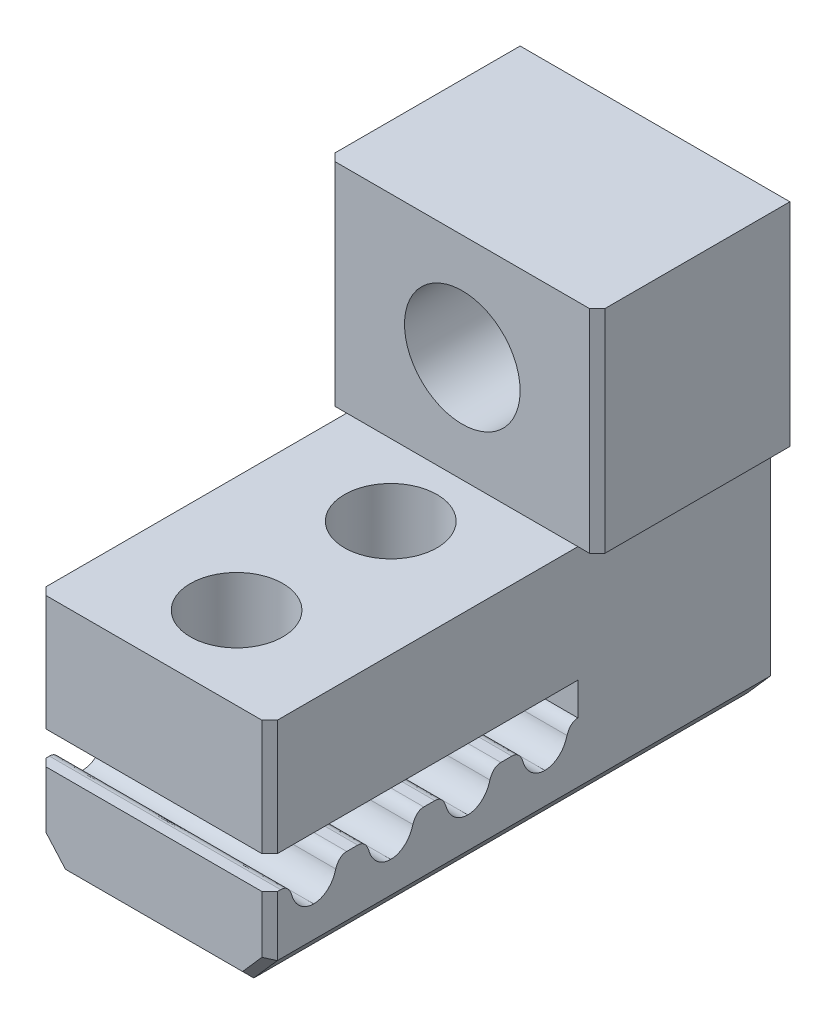
from build123d import *

# Parameters (mm, degrees)
BOSS_EXTRUDE1_DEPTH     = 13
SKETCH6_W               = 6
SKETCH6_H               = 5
BOSS_EXTRUDE4_DEPTH     = 5.6
SKETCH16_W              = 6
SKETCH16_H              = 8
BOSS_EXTRUDE5_DEPTH     = 0.1
CUT_EXTRUDE6_DEPTH      = 4
CUT_EXTRUDE6_DEPTH_BACK = 3.6
SKETCH15_R              = 1.2
CUT_EXTRUDE7_DEPTH      = 8.7202
CUT_EXTRUDE8_START      = -0.2202
SKETCH19_W              = 6
SKETCH19_H              = 8
SKETCH19_R              = 1.2
CUT_EXTRUDE8_DEPTH      = 0.2202
SKETCH12_R              = 1.5
CUT_EXTRUDE5_DEPTH      = 6
CHAMFER1_SIZE           = 0.2
SKETCH20_W              = 5
SKETCH20_H              = 5.5
BOSS_EXTRUDE6_DEPTH     = 0.5
SKETCH21_W              = 5
SKETCH21_H              = 5.5
BOSS_EXTRUDE7_DEPTH     = 0.5
CHAMFER2_SIZE           = 0.2


with BuildPart() as part:
    # Sketch1 → Boss-Extrude1 (new body)
    with BuildSketch(Plane.XY):
        Polygon((3, 3.05), (3, -2.253801214), (2.388188946, -2.95), (-2.388188946, -2.95), (-3, -2.253801214), (-3, 3.05), align=None)
    extrude(amount=BOSS_EXTRUDE1_DEPTH)

    # Sketch6 → Boss-Extrude4 (add)
    with BuildSketch(Plane(origin=(0, 3.05, 0), x_dir=(1, 0, 0), z_dir=(0, 1, 0))):
        with Locations((0, -2.5)):
            Rectangle(SKETCH6_W, SKETCH6_H)
    extrude(amount=BOSS_EXTRUDE4_DEPTH)

    # Sketch16 → Boss-Extrude5 (add)
    with BuildSketch(Plane(origin=(0, 3.05, 0), x_dir=(1, 0, 0), z_dir=(0, 1, 0))):
        with Locations((0, -9)):
            Rectangle(SKETCH16_W, SKETCH16_H)
    extrude(amount=BOSS_EXTRUDE5_DEPTH)

    # Sketch18 → Cut-Extrude6 (cut, two sides: drawn at the far end of the back side and taken through both)
    with BuildSketch(Plane(origin=(0, 0, 0), x_dir=(0, 0, -1), z_dir=(1, 0, 0)).offset(-CUT_EXTRUDE6_DEPTH_BACK)):
        with BuildLine():
            Line((-8.8572, -0.0702), (-12.8572, -0.0702))
            Line((-12.8572, -0.0702), (-13, -0.0702))
            Line((-13, -0.0702), (-13, -0.7))
            Line((-13, -0.7), (-12.8572, -0.7))
            Line((-12.8572, -0.7), (-12.7144, -0.7))
            add(Edge.make_bspline(
                [(-12.7144, -0.7), (-12.5198, -0.7), (-12.43, -0.9509)],
                knots=[0.103448276, 0.103448276, 0.103448276, 0.137931034, 0.137931034, 0.137931034], degree=2))
            add(Edge.make_bspline(
                [(-12.43, -0.9509), (-12.3594, -1.2388), (-12.13, -1.45), (-11.8572, -1.45)],
                knots=[0.137931034, 0.137931034, 0.137931034, 0.137931034, 0.172413793, 0.172413793, 0.172413793, 0.172413793], degree=3))
            add(Edge.make_bspline(
                [(-11.8572, -1.45), (-11.5844, -1.45), (-11.355, -1.2388), (-11.2844, -0.9509)],
                knots=[0.172413793, 0.172413793, 0.172413793, 0.172413793, 0.206896552, 0.206896552, 0.206896552, 0.206896552], degree=3))
            add(Edge.make_bspline(
                [(-11.2844, -0.9509), (-11.1946, -0.7), (-11, -0.7)],
                knots=[0.206896552, 0.206896552, 0.206896552, 0.24137931, 0.24137931, 0.24137931], degree=2))
            Line((-11, -0.7), (-10.8572, -0.7))
            Line((-10.8572, -0.7), (-10.7144, -0.7))
            add(Edge.make_bspline(
                [(-10.7144, -0.7), (-10.5198, -0.7), (-10.43, -0.9509)],
                knots=[0.310344828, 0.310344828, 0.310344828, 0.344827586, 0.344827586, 0.344827586], degree=2))
            add(Edge.make_bspline(
                [(-10.43, -0.9509), (-10.3594, -1.2388), (-10.13, -1.45), (-9.8572, -1.45)],
                knots=[0.344827586, 0.344827586, 0.344827586, 0.344827586, 0.379310345, 0.379310345, 0.379310345, 0.379310345], degree=3))
            add(Edge.make_bspline(
                [(-9.8572, -1.45), (-9.5844, -1.45), (-9.355, -1.2388), (-9.2844, -0.9509)],
                knots=[0.379310345, 0.379310345, 0.379310345, 0.379310345, 0.413793103, 0.413793103, 0.413793103, 0.413793103], degree=3))
            add(Edge.make_bspline(
                [(-9.2844, -0.9509), (-9.1946, -0.7), (-9, -0.7)],
                knots=[0.413793103, 0.413793103, 0.413793103, 0.448275862, 0.448275862, 0.448275862], degree=2))
            Line((-9, -0.7), (-8.8572, -0.7))
            Line((-8.8572, -0.7), (-8.7144, -0.7))
            add(Edge.make_bspline(
                [(-8.7144, -0.7), (-8.5198, -0.7), (-8.43, -0.9509)],
                knots=[0.517241379, 0.517241379, 0.517241379, 0.551724138, 0.551724138, 0.551724138], degree=2))
            add(Edge.make_bspline(
                [(-8.43, -0.9509), (-8.3594, -1.2388), (-8.13, -1.45), (-7.8572, -1.45)],
                knots=[0.551724138, 0.551724138, 0.551724138, 0.551724138, 0.586206897, 0.586206897, 0.586206897, 0.586206897], degree=3))
            add(Edge.make_bspline(
                [(-7.8572, -1.45), (-7.5844, -1.45), (-7.355, -1.2388), (-7.2844, -0.9509)],
                knots=[0.586206897, 0.586206897, 0.586206897, 0.586206897, 0.620689655, 0.620689655, 0.620689655, 0.620689655], degree=3))
            add(Edge.make_bspline(
                [(-7.2844, -0.9509), (-7.1946, -0.7), (-7, -0.7)],
                knots=[0.620689655, 0.620689655, 0.620689655, 0.655172414, 0.655172414, 0.655172414], degree=2))
            Line((-7, -0.7), (-6.8572, -0.7))
            Line((-6.8572, -0.7), (-6.7144, -0.7))
            add(Edge.make_bspline(
                [(-6.7144, -0.7), (-6.5198, -0.7), (-6.43, -0.9509)],
                knots=[0.724137931, 0.724137931, 0.724137931, 0.75862069, 0.75862069, 0.75862069], degree=2))
            add(Edge.make_bspline(
                [(-6.43, -0.9509), (-6.3594, -1.2388), (-6.13, -1.45), (-5.8572, -1.45)],
                knots=[0.75862069, 0.75862069, 0.75862069, 0.75862069, 0.793103448, 0.793103448, 0.793103448, 0.793103448], degree=3))
            add(Edge.make_bspline(
                [(-5.8572, -1.45), (-5.5844, -1.45), (-5.355, -1.2388), (-5.2844, -0.9509)],
                knots=[0.793103448, 0.793103448, 0.793103448, 0.793103448, 0.827586207, 0.827586207, 0.827586207, 0.827586207], degree=3))
            add(Edge.make_bspline(
                [(-5.2844, -0.9509), (-5.1946, -0.7), (-5, -0.7)],
                knots=[0.827586207, 0.827586207, 0.827586207, 0.862068966, 0.862068966, 0.862068966], degree=2))
            Line((-5, -0.7), (-5, -0.0702))
            Line((-5, -0.0702), (-8.8572, -0.0702))
        make_face()
    extrude(amount=CUT_EXTRUDE6_DEPTH + CUT_EXTRUDE6_DEPTH_BACK, mode=Mode.SUBTRACT)

    # Sketch15 → Cut-Extrude7 (cut)
    with BuildSketch(Plane(origin=(0, 8.65, 0), x_dir=(1, 0, 0), z_dir=(0, 1, 0))):
        with Locations(Location((0, -10.8572, 0), (0, 0, 180))):
            Circle(SKETCH15_R)
        with Locations(Location((0, -6.8572, 0), (0, 0, 180))):
            Circle(SKETCH15_R)
    extrude(amount=-CUT_EXTRUDE7_DEPTH, mode=Mode.SUBTRACT)

    # Sketch19 → Cut-Extrude8 (cut)
    with BuildSketch(Plane.XZ.offset(0.0702).offset(CUT_EXTRUDE8_START)):
        with Locations((0, 9)):
            Rectangle(SKETCH19_W, SKETCH19_H)
        with Locations(Location((0, 10.8572, 0), (0, 0, 180))):
            Circle(SKETCH19_R, mode=Mode.SUBTRACT)
        with Locations(Location((0, 6.8572, 0), (0, 0, 180))):
            Circle(SKETCH19_R, mode=Mode.SUBTRACT)
    extrude(amount=CUT_EXTRUDE8_DEPTH, mode=Mode.SUBTRACT)

    # Sketch12 → Cut-Extrude5 (cut)
    with BuildSketch(Plane.XY.offset(5)):
        with Locations((0, 5.9)):
            Circle(SKETCH12_R)
    extrude(amount=-CUT_EXTRUDE5_DEPTH, mode=Mode.SUBTRACT)

    # Chamfer1
    chamfer1_edges = [part.edges().sort_by_distance(p)[0] for p in [
        (-2.694094473, -2.601900607, 13),
        (0, -2.95, 13),
        (2.694094473, -2.601900607, 13),
        (3, 1.65, 13),
        (3, -1.476900607, 13),
        (-3, -1.476900607, 13),
        (-3, 1.65, 13),
    ]]
    chamfer(chamfer1_edges, length=CHAMFER1_SIZE)

    # Sketch20 → Boss-Extrude6 (add)
    with BuildSketch(Plane(origin=(3, 0, 0), x_dir=(0, 0, -1), z_dir=(1, 0, 0))):
        with Locations((-2.5, 5.9)):
            Rectangle(SKETCH20_W, SKETCH20_H)
    extrude(amount=BOSS_EXTRUDE6_DEPTH)

    # Sketch21 → Boss-Extrude7 (add)
    with BuildSketch(Plane.ZY.offset(3)):
        with Locations((2.5, 5.9)):
            Rectangle(SKETCH21_W, SKETCH21_H)
    extrude(amount=BOSS_EXTRUDE7_DEPTH)

    # Chamfer2
    chamfer2_edges = [part.edges().sort_by_distance(p)[0] for p in [
        (3.5, 5.9, 5),
        (-3.5, 5.9, 5),
    ]]
    chamfer(chamfer2_edges, length=CHAMFER2_SIZE)


solid = part.part
